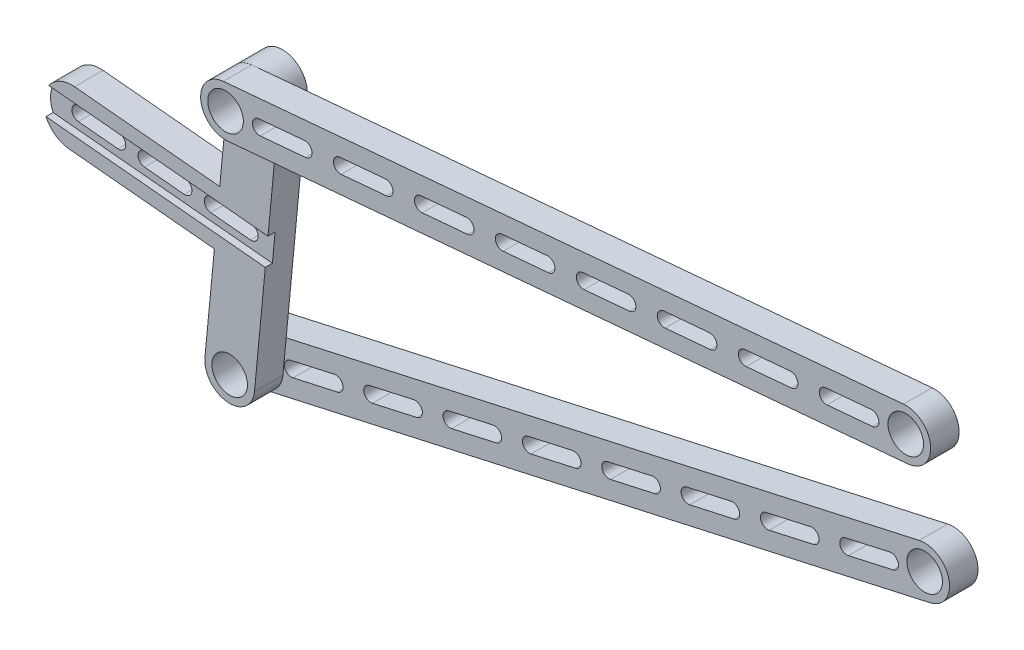
from build123d import *

# Parameters (mm, degrees)
INPUTLINK_DEPTH                         = 6.35
COUPLERLINK_DEPTH                       = 6.35
FOLLOWERLINK_DEPTH                      = 6.35
CUT_EXTRUDE1_DEPTH                      = 1.5875
SKETCH6_W                               = 3.96875
SKETCH6_H                               = 19.05
F_5_16_0_3125_DIAMETER_HOLE1_AT_2_COUNT = 2
F_5_16_0_3125_DIAMETER_HOLE1_AT_2_PITCH = 152.37968
F_5_16_0_3125_DIAMETER_HOLE1_AT_3_COUNT = 2
F_5_16_0_3125_DIAMETER_HOLE1_AT_3_PITCH = 145.246731087
F_5_16_0_3125_DIAMETER_HOLE1_AT_4_COUNT = 2
F_5_16_0_3125_DIAMETER_HOLE1_AT_4_PITCH = 38.131717917
CUT_EXTRUDE2_DEPTH                      = 227.895795764
LPATTERN1_COUNT                         = 8
LPATTERN1_PITCH                         = 18.139954286
CUT_EXTRUDE3_DEPTH                      = 228.339645982
LPATTERN2_COUNT                         = 8
LPATTERN2_PITCH                         = 18.141768571
CUT_EXTRUDE5_DEPTH                      = 227.812477152
LPATTERN3_COUNT                         = 3
LPATTERN3_PITCH                         = 14.843125


with BuildPart() as part:
    # Sketch2 → InputLink (new body)
    with BuildSketch(Plane(origin=(0, 0, 0), x_dir=(0, 1, 0), z_dir=(0, 0, 1))):
        with BuildLine():
            Line((61.661461605, 132.964365452), (94.802613233, -15.767712277))
            ThreePointArc((94.802613233, -15.767712277), (101.434292277, -19.982526767), (105.649106767, -13.350847723))
            Line((105.649106767, -13.350847723), (72.507955138, 135.381230007))
            ThreePointArc((72.507955138, 135.381230007), (65.876276094, 139.596044496), (61.661461605, 132.964365452))
        make_face()
    extrude(amount=INPUTLINK_DEPTH)

    # Sketch6 → 5/16 (0.3125) Diameter Hole1 (revolve, cut)
    with BuildSketch(Plane(origin=(14.55928, 100.22586, 0), x_dir=(0, 1, 0), z_dir=(1, 0, 0))):
        with Locations((1.984375, 9.525)):
            Rectangle(SKETCH6_W, SKETCH6_H)
    f_5_16_0_3125_diameter_hole1 = revolve(axis=Axis((14.55928, 100.22586, -6.35), (0, 0, 1)), mode=Mode.SUBTRACT)


with BuildPart() as body_2:
    # Sketch3 → CouplerLink (new body)
    with BuildSketch(Plane.XY.offset(6.35)):
        with BuildLine():
            Line((-128.641723213, 66.556381999), (-123.215720795, 123.361465467))
            ThreePointArc((-123.215720795, 123.361465467), (-128.218468939, 129.420866356), (-134.277869828, 124.418118212))
            Line((-134.277869828, 124.418118212), (-136.387069468, 102.336804497))
            Line((-136.387069468, 102.336804497), (-168.783363065, 105.431287537))
            ThreePointArc((-168.783363065, 105.431287537), (-175.708392652, 99.713861087), (-169.990966202, 92.788831499))
            Line((-169.990966202, 92.788831499), (-137.594672606, 89.69434846))
            Line((-137.594672606, 89.69434846), (-139.703872246, 67.613034744))
            ThreePointArc((-139.703872246, 67.613034744), (-134.701124102, 61.553633855), (-128.641723213, 66.556381999))
        make_face()
    extrude(amount=COUPLERLINK_DEPTH)

    # Sketch5 → Cut-Extrude1 (cut)
    with BuildSketch(Plane.XY.offset(12.7)):
        with BuildLine():
            Line((-112.19421168, 96.836459409), (-188.048947905, 104.082078234))
            ThreePointArc((-188.048947905, 104.082078234), (-191.511462699, 101.223365009), (-188.652749474, 97.760850215))
            Line((-188.652749474, 97.760850215), (-112.798013249, 90.51523139))
            ThreePointArc((-112.798013249, 90.51523139), (-109.335498455, 93.373944615), (-112.19421168, 96.836459409))
        make_face()
    extrude(amount=-CUT_EXTRUDE1_DEPTH, mode=Mode.SUBTRACT)


with BuildPart() as body_3:
    # Sketch4 → FollowerLink (new body)
    with BuildSketch(Plane.XY.offset(12.7)):
        with BuildLine():
            Line((-128.254163612, 118.355423938), (23.5380517, 131.866932098))
            ThreePointArc((23.5380517, 131.866932098), (28.579787902, 137.8939317), (22.5527883, 142.935667902))
            Line((22.5527883, 142.935667902), (-129.239427012, 129.424159741))
            ThreePointArc((-129.239427012, 129.424159741), (-134.281163214, 123.39716014), (-128.254163612, 118.355423938))
        make_face()
    extrude(amount=FOLLOWERLINK_DEPTH)


with BuildPart() as f_5_16_0_3125_diameter_hole1_at_2_tool:
    # 5/16 (0.3125) Diameter Hole1 at 2: 5/16 (0.3125) Diameter Hole1 ×2
    with Locations(*[Vector(-0.9760624102191325, -0.2174906236075887, 0) * (i * F_5_16_0_3125_DIAMETER_HOLE1_AT_2_PITCH) for i in range(1, F_5_16_0_3125_DIAMETER_HOLE1_AT_2_COUNT)]):
        add(f_5_16_0_3125_diameter_hole1)


with BuildPart() as part_1:
    add(part.part)

    # 5/16 (0.3125) Diameter Hole1 at 2: cut by f_5_16_0_3125_diameter_hole1_at_2_tool
    add(f_5_16_0_3125_diameter_hole1_at_2_tool.part, mode=Mode.SUBTRACT)

    # Sketch7 → Cut-Extrude2 (cut, through all)
    with BuildSketch(Plane.XY.offset(6.35)):
        with BuildLine():
            Line((-127.080468528, 70.291486), (-117.163674441, 72.501190736))
            ThreePointArc((-117.163674441, 72.501190736), (-115.268908999, 71.296958024), (-116.473141711, 69.402192583))
            Line((-116.473141711, 69.402192583), (-126.389935798, 67.192487847))
            ThreePointArc((-126.389935798, 67.192487847), (-128.28470124, 68.396720559), (-127.080468528, 70.291486))
        make_face()
    cut_extrude2 = extrude(amount=-CUT_EXTRUDE2_DEPTH, mode=Mode.SUBTRACT)

    # LPattern1: Cut-Extrude2 ×8
    with Locations(*[Vector(0.9760624102191326, 0.2174906236075885, 0) * (i * LPATTERN1_PITCH) for i in range(1, LPATTERN1_COUNT)]):
        add(cut_extrude2, mode=Mode.SUBTRACT)


with BuildPart() as body_2_1:
    add(body_2.part)

    # 5/16 (0.3125) Diameter Hole1 at 2: cut by f_5_16_0_3125_diameter_hole1_at_2_tool
    add(f_5_16_0_3125_diameter_hole1_at_2_tool.part, mode=Mode.SUBTRACT)


with BuildPart() as f_5_16_0_3125_diameter_hole1_at_3_tool:
    # 5/16 (0.3125) Diameter Hole1 at 3: 5/16 (0.3125) Diameter Hole1 ×2
    with Locations(*[Vector(-0.9866389022291044, 0.16292230236572197, 0) * (i * F_5_16_0_3125_DIAMETER_HOLE1_AT_3_PITCH) for i in range(1, F_5_16_0_3125_DIAMETER_HOLE1_AT_3_COUNT)]):
        add(f_5_16_0_3125_diameter_hole1)


with BuildPart() as body_2_2:
    add(body_2_1.part)

    # 5/16 (0.3125) Diameter Hole1 at 3: cut by f_5_16_0_3125_diameter_hole1_at_3_tool
    add(f_5_16_0_3125_diameter_hole1_at_3_tool.part, mode=Mode.SUBTRACT)

    # Sketch9 → Cut-Extrude5 (cut, through all)
    with BuildSketch(Plane.XY.offset(11.1125)):
        with BuildLine():
            Line((-160.688395799, 96.684430317), (-169.538115026, 97.529752513))
            ThreePointArc((-169.538115026, 97.529752513), (-170.967471638, 99.26100991), (-169.236214241, 100.690366523))
            Line((-169.236214241, 100.690366523), (-160.386495015, 99.845044327))
            ThreePointArc((-160.386495015, 99.845044327), (-158.957138402, 98.11378693), (-160.688395799, 96.684430317))
        make_face()
    cut_extrude5 = extrude(amount=-CUT_EXTRUDE5_DEPTH, mode=Mode.SUBTRACT)

    # LPattern3: Cut-Extrude5 ×3
    with Locations(*[Vector(0.9954689793376904, -0.09508686121845066, 0) * (i * LPATTERN3_PITCH) for i in range(1, LPATTERN3_COUNT)]):
        add(cut_extrude5, mode=Mode.SUBTRACT)


with BuildPart() as body_3_1:
    add(body_3.part)

    # 5/16 (0.3125) Diameter Hole1 at 3: cut by f_5_16_0_3125_diameter_hole1_at_3_tool
    add(f_5_16_0_3125_diameter_hole1_at_3_tool.part, mode=Mode.SUBTRACT)

    # 5/16 (0.3125) Diameter Hole1 at 4: 5/16 (0.3125) Diameter Hole1 ×2
    with Locations(*[Vector(0.22254806401579308, 0.9749217195256358, 0) * (i * F_5_16_0_3125_DIAMETER_HOLE1_AT_4_PITCH) for i in range(1, F_5_16_0_3125_DIAMETER_HOLE1_AT_4_COUNT)]):
        add(f_5_16_0_3125_diameter_hole1, mode=Mode.SUBTRACT)

    # Sketch8 → Cut-Extrude3 (cut, through all)
    with BuildSketch(Plane.XY.offset(19.05)):
        with BuildLine():
            Line((-110.896066112, 123.884965308), (-121.016053133, 122.984153056))
            ThreePointArc((-121.016053133, 122.984153056), (-122.738053019, 124.424649114), (-121.297556961, 126.146649))
            Line((-121.297556961, 126.146649), (-111.177569941, 127.047461251))
            ThreePointArc((-111.177569941, 127.047461251), (-109.455570055, 125.606965194), (-110.896066112, 123.884965308))
        make_face()
    cut_extrude3 = extrude(amount=-CUT_EXTRUDE3_DEPTH, mode=Mode.SUBTRACT)

    # LPattern2: Cut-Extrude3 ×8
    with Locations(*[Vector(0.9960617145812697, 0.08866262315892334, 0) * (i * LPATTERN2_PITCH) for i in range(1, LPATTERN2_COUNT)]):
        add(cut_extrude3, mode=Mode.SUBTRACT)


solid = Compound([part_1.part, body_2_2.part, body_3_1.part])
